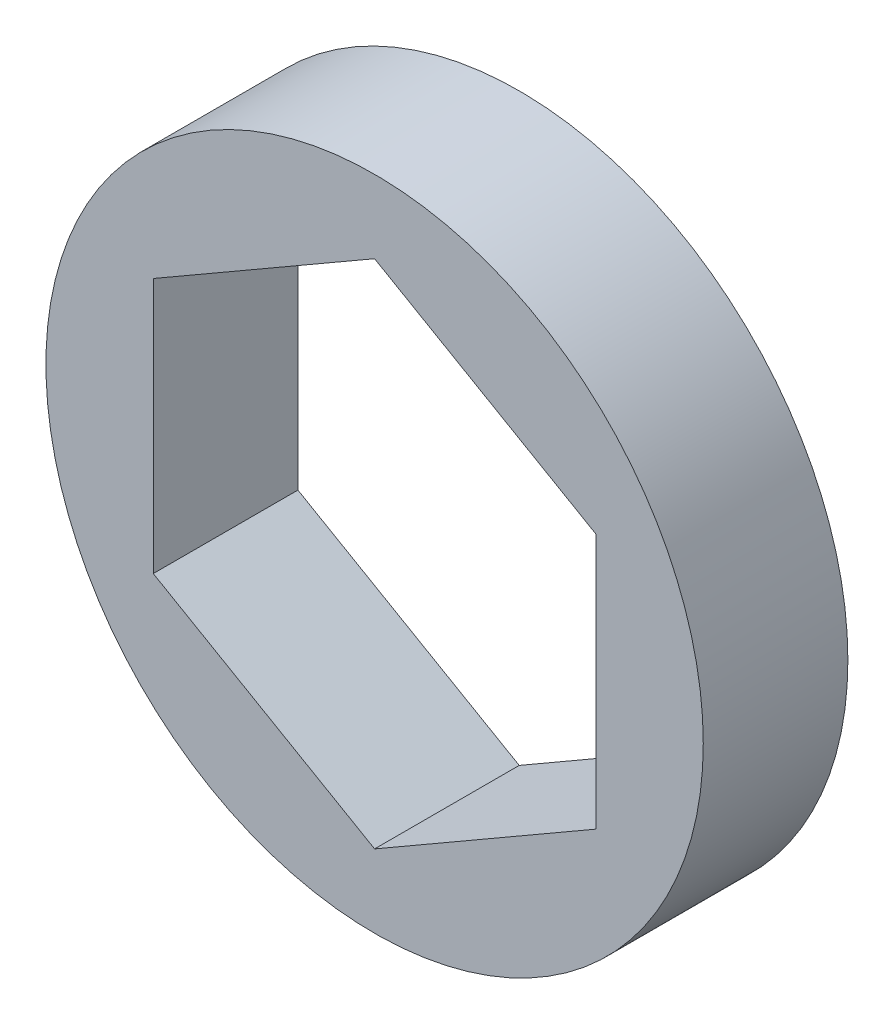
from build123d import *

# Parameters (mm, degrees)
SKETCH2_R           = 9.525
BOSS_EXTRUDE1_DEPTH = 4.191


with BuildPart() as part:
    # Sketch2 → Boss-Extrude1 (new body)
    with BuildSketch(Plane.XY):
        Circle(SKETCH2_R)
        Polygon((6.4135, 3.702835951), (0, 7.405671903), (-6.4135, 3.702835951), (-6.4135, -3.702835951), (0, -7.405671903), (6.4135, -3.702835951), align=None, mode=Mode.SUBTRACT)
    extrude(amount=BOSS_EXTRUDE1_DEPTH)


solid = part.part
